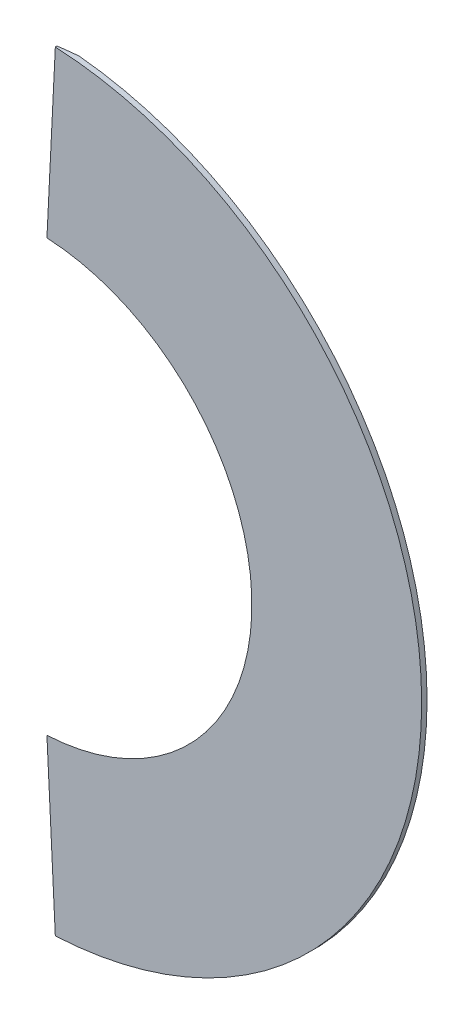
from build123d import *

# Parameters (mm, degrees)
BOSS_EXTRUDE1_DEPTH     = 2
CUT_EXTRUDE1_DEPTH      = 203.119002293
CUT_EXTRUDE1_DEPTH_BACK = 203.119002293
SKETCH2_R               = 80
CUT_EXTRUDE2_DEPTH      = 203.119002293
CUT_EXTRUDE2_DEPTH_BACK = 203.119002293


with BuildPart() as part:
    # Sketch1 → Boss-Extrude1 (new body)
    with BuildSketch(Plane.XY):
        with BuildLine():
            Line((0, 0), (7.064623984, 142.825386707))
            ThreePointArc((7.064623984, 142.825386707), (143, 0.000219219), (7.065061887, -142.825365046))
            Line((7.065061887, -142.825365046), (0, 0))
        make_face()
    extrude(amount=BOSS_EXTRUDE1_DEPTH)

    # Sketch2 → Cut-Extrude1 (cut, two sides: drawn at the far end of the back side and taken through both)
    with BuildSketch(Plane(origin=(0, 0, 0), x_dir=(-1, 0, 0), z_dir=(0, 0, -1)).offset(-CUT_EXTRUDE1_DEPTH_BACK)):
        Circle(SKETCH2_R)
    extrude(amount=CUT_EXTRUDE1_DEPTH + CUT_EXTRUDE1_DEPTH_BACK, mode=Mode.SUBTRACT)

    # Sketch3 → Cut-Extrude2 (cut, two sides: drawn at the far end of the back side and taken through both)
    with BuildSketch(Plane(origin=(0, 0, 0), x_dir=(1, 0, 0), z_dir=(0, 1, 0)).offset(-CUT_EXTRUDE2_DEPTH_BACK)):
        Polygon((3.952237194, -2), (13.952237194, 0), (3.952237194, 0), align=None)
    extrude(amount=CUT_EXTRUDE2_DEPTH + CUT_EXTRUDE2_DEPTH_BACK, mode=Mode.SUBTRACT)

    # Sketch5 → Cut-Revolve1 (revolve, cut)
    with BuildSketch(Plane(origin=(0, 0, 0), x_dir=(1, 0, 0), z_dir=(0, 1, 0))):
        Polygon((80, -2), (90, 0), (80, 0), align=None)
    revolve(axis=Axis((0, 0, 0), (0, 0, -1)), mode=Mode.SUBTRACT)


solid = part.part
